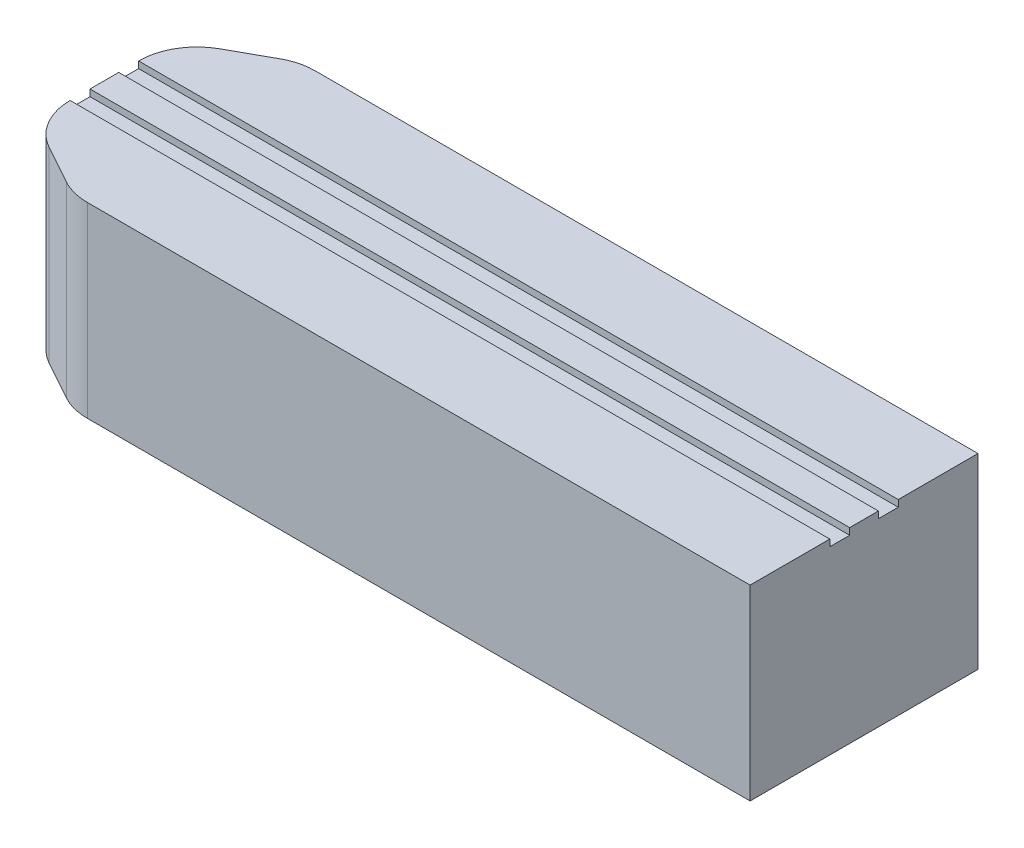
from build123d import *

# Parameters (mm, degrees)
CROQUIS1_W              = 65
CROQUIS1_H              = 19.5
SALIENTE_EXTRUIR1_DEPTH = 16
CORTAR_EXTRUIR1_DEPTH   = 16
REDONDEO1_R             = 5
CROQUIS4_W              = 65
CROQUIS4_H              = 1.7
CORTAR_EXTRUIR2_DEPTH   = 0.57


with BuildPart() as part:
    # Croquis1 → Saliente-Extruir1 (new body)
    with BuildSketch(Plane(origin=(0, 0, 0), x_dir=(1, 0, 0), z_dir=(0, 1, 0))):
        with Locations((5.631188119, 0.14480198)):
            Rectangle(CROQUIS1_W, CROQUIS1_H)
    extrude(amount=SALIENTE_EXTRUIR1_DEPTH)

    # Croquis2 → Cortar-Extruir1 (cut)
    with BuildSketch(Plane(origin=(0, 16, 0), x_dir=(1, 0, 0), z_dir=(0, 1, 0))):
        Polygon((-26.868811881, 6.021818634), (-19.868811881, 9.89480198), (-26.868811881, 9.89480198), align=None)
        Polygon((-26.868811881, -9.60519802), (-19.868811881, -9.60519802), (-26.868811881, -5.732214674), align=None)
    extrude(amount=-CORTAR_EXTRUIR1_DEPTH, mode=Mode.SUBTRACT)

    # Redondeo1
    redondeo1_edges = [part.edges().sort_by_distance(p)[0] for p in [
        (-19.868811881, 8, -9.89480198),
        (-26.868811881, 8, -6.021818634),
        (-26.868811881, 8, 5.732214674),
        (-19.868811881, 8, 9.60519802),
    ]]
    fillet(redondeo1_edges, radius=REDONDEO1_R)

    # Croquis4 → Cortar-Extruir2 (cut)
    with BuildSketch(Plane(origin=(0, 16, 0), x_dir=(1, 0, 0), z_dir=(0, 1, 0))):
        with Locations((5.631188119, 2.223949596)):
            Rectangle(CROQUIS4_W, CROQUIS4_H)
        with Locations((5.631188119, -1.934345635)):
            Rectangle(CROQUIS4_W, CROQUIS4_H)
    extrude(amount=-CORTAR_EXTRUIR2_DEPTH, mode=Mode.SUBTRACT)


solid = part.part
